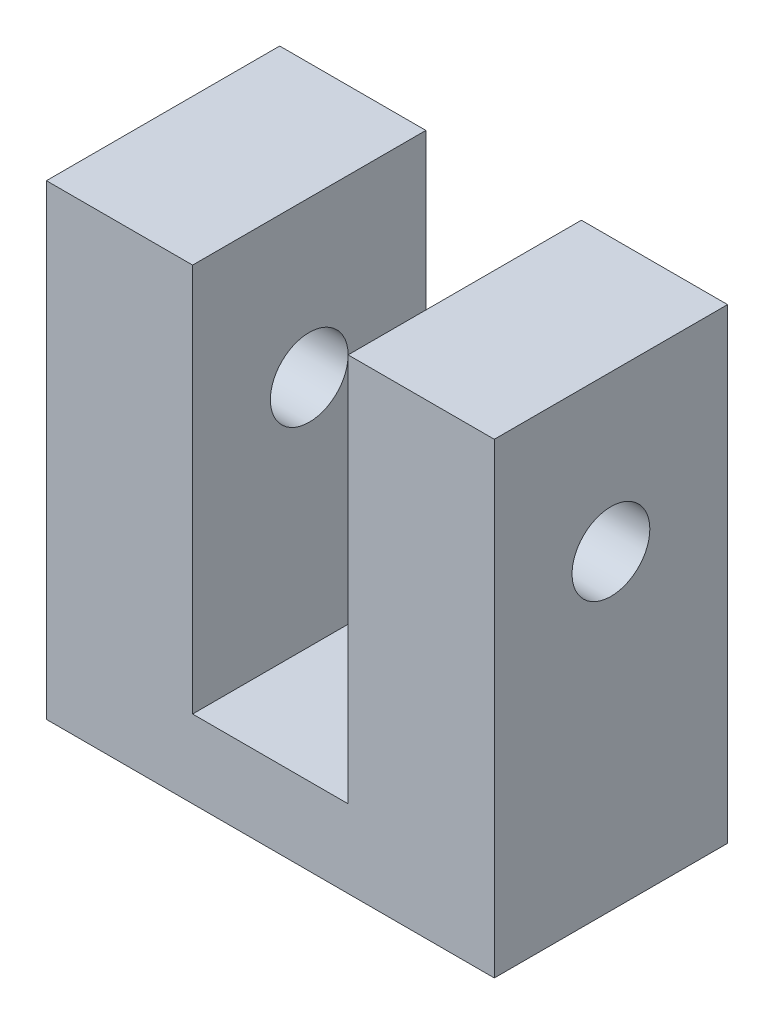
from build123d import *

# Parameters (mm, degrees)
BOSS_EXTRUDE1_DEPTH = 9.525
HOLE1_D             = 6.35
HOLE2_D             = 6.35
HOLE2_DEPTH         = 12.7


with BuildPart() as part:
    # Sketch1 → Boss-Extrude1 (new, symmetric)
    with BuildSketch(Plane.XY):
        Polygon((-18.288, 0), (-18.288, 38.1), (-6.35, 38.1), (-6.35, 6.35), (6.35, 6.35), (6.35, 38.1), (18.288, 38.1), (18.288, 0), align=None)
    extrude(amount=BOSS_EXTRUDE1_DEPTH, both=True)

    # Hole1 (through all)
    with Locations(Plane(origin=(18.288, 0, 0), x_dir=(0, 0, -1), z_dir=(1, 0, 0))):
        with Locations((0, 25.4)):
            Hole(HOLE1_D / 2)

    # Hole2
    with Locations(Plane(origin=(0, 0, 0), x_dir=(-1, 0, 0), z_dir=(0, -1, 0))):
        with Locations((-13.208, -3.175), (12.192, -3.175)):
            Hole(HOLE2_D / 2, depth=HOLE2_DEPTH)


solid = part.part
